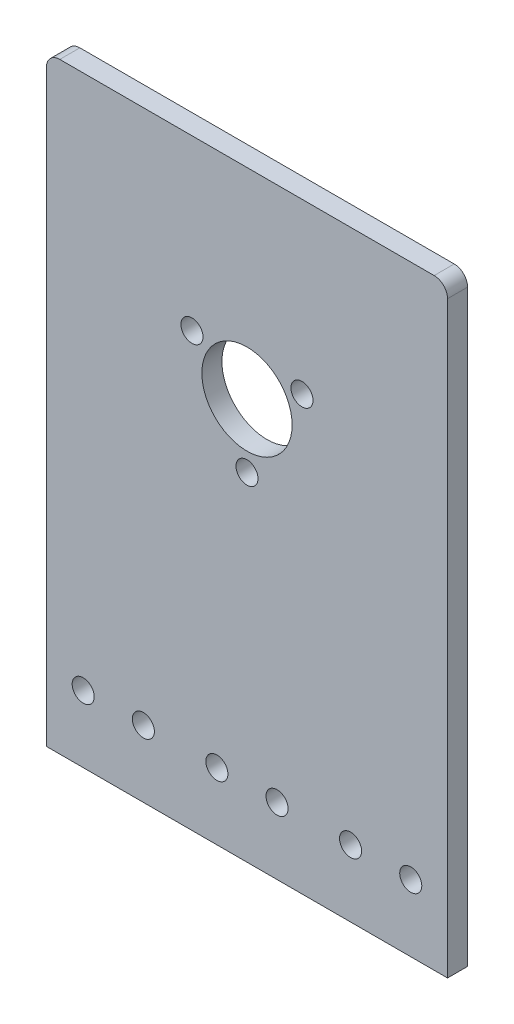
from build123d import *

# Parameters (mm, degrees)
SKETCH_1_W          = 60
SKETCH_1_H          = 90
EXTRUDE_1_DEPTH     = 3
SKETCH_2_R          = 1.65
CUT_EXTRUDE_1_DEPTH = 3
SKETCH_3_R          = 1.65
CUT_EXTRUDE_2_DEPTH = 3
SKETCH_4_R          = 6.75
CUT_EXTRUDE_3_DEPTH = 3
FILLET_1_R          = 2


with BuildPart() as part:
    # 草图1 → 凸台-拉伸1 (new body)
    with BuildSketch(Plane.XY):
        Rectangle(SKETCH_1_W, SKETCH_1_H)
    extrude(amount=EXTRUDE_1_DEPTH)

    # 草图2 → 切除-拉伸1 (cut)
    with BuildSketch(Plane.XY.offset(3)):
        with Locations((0, 5.5)):
            Circle(SKETCH_2_R)
        with Locations((-8.227241336, 19.75)):
            Circle(SKETCH_2_R)
        with Locations((8.227241336, 19.75)):
            Circle(SKETCH_2_R)
    extrude(amount=-CUT_EXTRUDE_1_DEPTH, mode=Mode.SUBTRACT)

    # 草图3 → 切除-拉伸2 (cut)
    with BuildSketch(Plane.XY.offset(3)):
        with Locations((4.5, -35)):
            Circle(SKETCH_3_R)
        with Locations((-4.5, -35)):
            Circle(SKETCH_3_R)
        with Locations((24.5, -35)):
            Circle(SKETCH_3_R)
        with Locations((15.5, -35)):
            Circle(SKETCH_3_R)
        with Locations((-24.5, -35)):
            Circle(SKETCH_3_R)
        with Locations((-15.5, -35)):
            Circle(SKETCH_3_R)
    extrude(amount=-CUT_EXTRUDE_2_DEPTH, mode=Mode.SUBTRACT)

    # 草图4 → 切除-拉伸3 (cut)
    with BuildSketch(Plane.XY.offset(3)):
        with Locations((0, 15)):
            Circle(SKETCH_4_R)
    extrude(amount=-CUT_EXTRUDE_3_DEPTH, mode=Mode.SUBTRACT)

    # 圆角1
    fillet_1_edges = [part.edges().sort_by_distance(p)[0] for p in [
        (-30, 45, 1.5),
        (30, 45, 1.5),
    ]]
    fillet(fillet_1_edges, radius=FILLET_1_R)


solid = part.part
